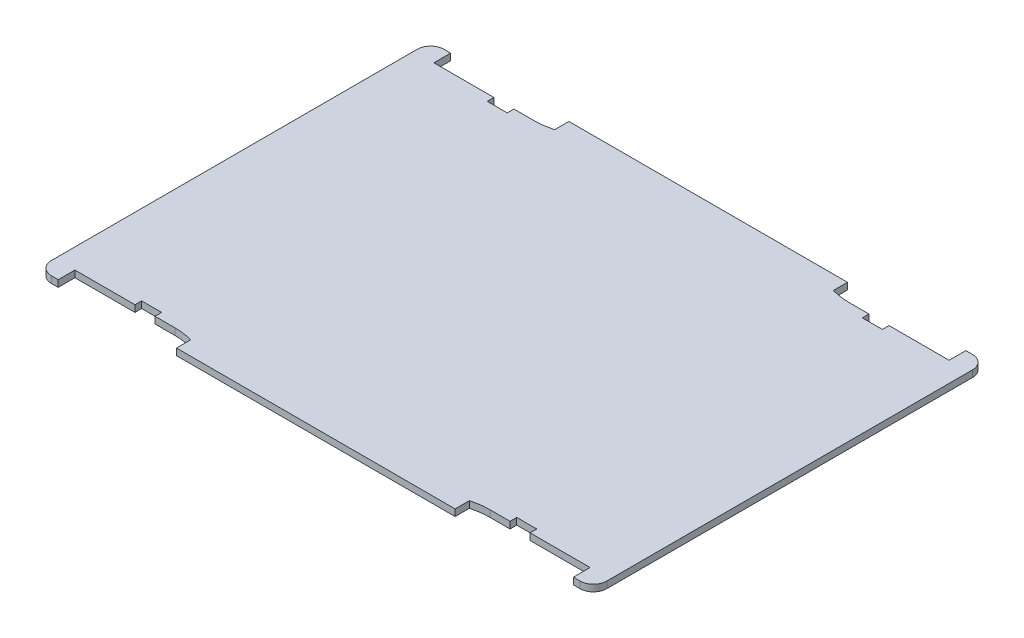
from build123d import *

# Parameters (mm, degrees)
CROQUIS1_W              = 416
CROQUIS1_H              = 294
SALIENTE_EXTRUIR1_DEPTH = 5
CORTAR_EXTRUIR1_DEPTH   = 255.750858684
SIMETR_A2_COPY_1_DEPTH  = 255.750858684
REDONDEO1_R             = 10


with BuildPart() as part:
    # Croquis1 → Saliente-Extruir1 (new body)
    with BuildSketch(Plane(origin=(0, 0, 0), x_dir=(1, 0, 0), z_dir=(0, 1, 0))):
        Rectangle(CROQUIS1_W, CROQUIS1_H)
    extrude(amount=SALIENTE_EXTRUIR1_DEPTH)

    # Croquis2 → Cortar-Extruir1 (cut, through all)
    with BuildSketch(Plane(origin=(0, 5, 0), x_dir=(1, 0, 0), z_dir=(0, 1, 0))):
        with BuildLine():
            Line((-193, 154.467494322), (-193, 134.467494322))
            Line((-193, 134.467494322), (-148, 134.467494322))
            Line((-148, 134.467494322), (-148, 129.467494322))
            Line((-148, 129.467494322), (-133, 129.467494322))
            Line((-133, 129.467494322), (-133, 134.467494322))
            Line((-133, 134.467494322), (-118, 134.467494322))
            ThreePointArc((-118, 134.467494322), (-111.121581436, 134.942880664), (-104.373959122, 136.36))
            Line((-104.373959122, 136.36), (-104.373959122, 156.36))
            Line((-104.373959122, 156.36), (-193.373959122, 156.36))
            Line((-193.373959122, 156.36), (-193, 154.467494322))
        make_face()
    cortar_extruir1 = extrude(amount=-CORTAR_EXTRUIR1_DEPTH, mode=Mode.SUBTRACT)

    # Simetría1: Cortar-Extruir1 across plane
    add(cortar_extruir1.mirror(Plane.XY), mode=Mode.SUBTRACT)

    # Simetría2: Cortar-Extruir1 across plane
    add(cortar_extruir1.mirror(Plane(origin=(0, 0, 0), x_dir=(0, 0, 1), z_dir=(1, 0, 0))), mode=Mode.SUBTRACT)

    # Simetría2 copy 1 sketch → Simetría2 copy 1 (cut, through all)
    with BuildSketch(Plane(origin=(0, 5, 0), x_dir=(-1, 0, 0), z_dir=(0, 1, 0))):
        with BuildLine():
            Line((-193, 154.467494322), (-193, 134.467494322))
            Line((-193, 134.467494322), (-148, 134.467494322))
            Line((-148, 134.467494322), (-148, 129.467494322))
            Line((-148, 129.467494322), (-133, 129.467494322))
            Line((-133, 129.467494322), (-133, 134.467494322))
            Line((-133, 134.467494322), (-118, 134.467494322))
            ThreePointArc((-118, 134.467494322), (-111.121581436, 134.942880664), (-104.373959122, 136.36))
            Line((-104.373959122, 136.36), (-104.373959122, 156.36))
            Line((-104.373959122, 156.36), (-193.373959122, 156.36))
            Line((-193.373959122, 156.36), (-193, 154.467494322))
        make_face()
    extrude(amount=-SIMETR_A2_COPY_1_DEPTH, mode=Mode.SUBTRACT)

    # Redondeo1
    redondeo1_edges = [part.edges().sort_by_distance(p)[0] for p in [
        (208, 2.5, 147),
        (-208, 2.5, 147),
        (-208, 2.5, -147),
        (208, 2.5, -147),
    ]]
    fillet(redondeo1_edges, radius=REDONDEO1_R)


solid = part.part
